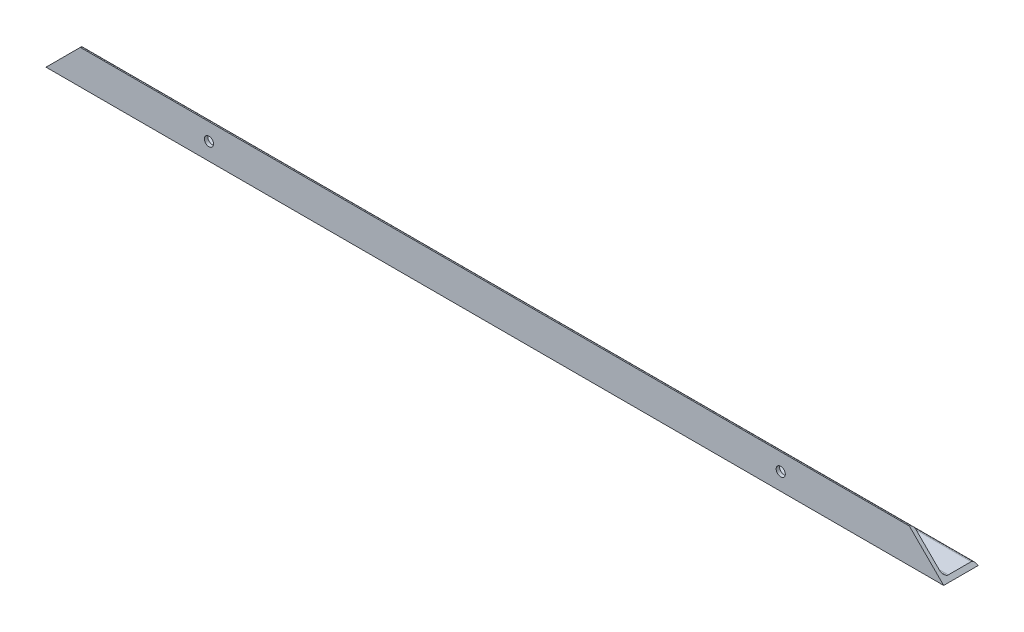
from build123d import *

# Parameters (mm, degrees)
L_ANGLE_EQUAL_60X60X6_3_DEPTH = 1570
SKETCH14_R                    = 8
CUT_EXTRUDE1_DEPTH            = 1573.291321607


with BuildPart() as part:
    # Sketch17 → L angle (equal) 60X60X6(3) (new body)
    with BuildSketch(Plane(origin=(0, 0, 0), x_dir=(0, 0, -1), z_dir=(1, 0, 0))):
        with BuildLine():
            Line((0, 60), (0, 0))
            Line((0, 0), (60, 0))
            ThreePointArc((60, 0), (58.242640687, 4.242640687), (54, 6))
            Line((54, 6), (14, 6))
            ThreePointArc((14, 6), (8.343145751, 8.343145751), (6, 14))
            Line((6, 14), (6, 54))
            ThreePointArc((6, 54), (4.242640687, 58.242640687), (0, 60))
        make_face()
    extrude(amount=L_ANGLE_EQUAL_60X60X6_3_DEPTH)

    # Sketch14 → Cut-Extrude1 (cut, through all)
    with BuildSketch(Plane.XY):
        with Locations((285, 30)):
            Circle(SKETCH14_R)
        with Locations((1285, 30)):
            Circle(SKETCH14_R)
        Polygon((1570, 0), (1570, 60), (1510, 60), align=None)
        Polygon((0, 60), (0, 0), (60, 60), align=None)
    extrude(amount=-CUT_EXTRUDE1_DEPTH, mode=Mode.SUBTRACT)


solid = part.part
